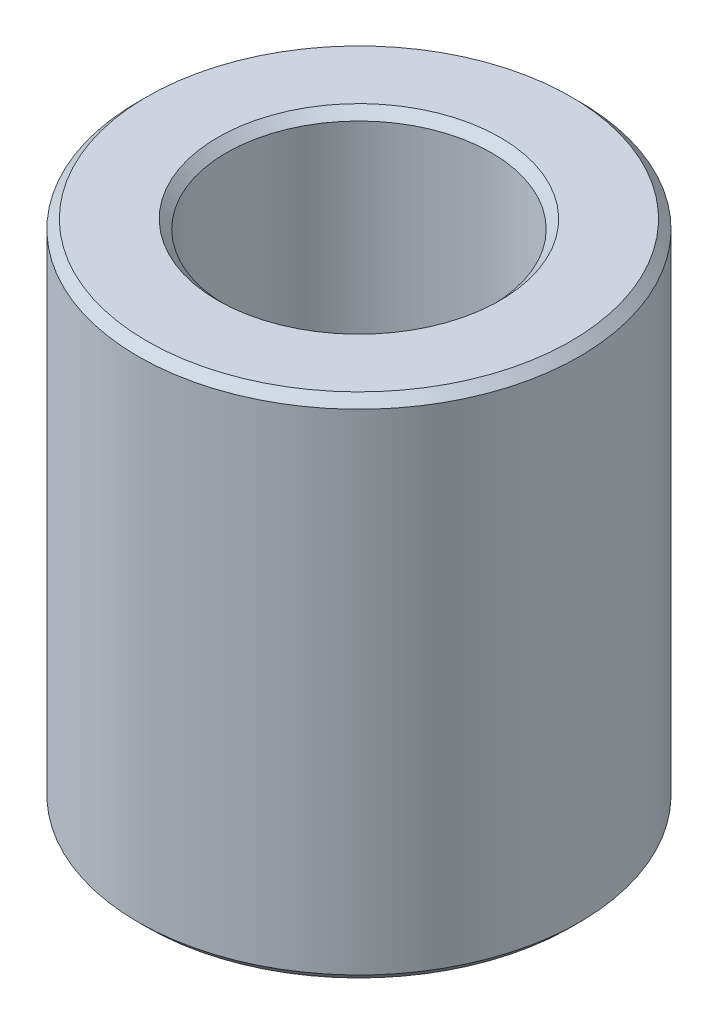
from build123d import *

# Parameters (mm, degrees)
SKETCH1_R           = 5
SKETCH1_R_2         = 3
BOSS_EXTRUDE1_DEPTH = 11.5
CHAMFER1_SIZE       = 0.2


with BuildPart() as part:
    # Sketch1 → Boss-Extrude1 (new body)
    with BuildSketch(Plane(origin=(0, 0, 0), x_dir=(1, 0, 0), z_dir=(0, 1, 0))):
        with Locations(Location((0, 0, 0), (0, 0, 270))):
            Circle(SKETCH1_R)
        with Locations(Location((0, 0, 0), (0, 0, 270))):
            Circle(SKETCH1_R_2, mode=Mode.SUBTRACT)
    extrude(amount=BOSS_EXTRUDE1_DEPTH)

    # Chamfer1
    chamfer1_edges = [part.edges().sort_by_distance(p)[0] for p in [
        (0, 0, -5),
        (0, 11.5, -5),
        (0, 0, -3),
        (0, 11.5, -3),
    ]]
    chamfer(chamfer1_edges, length=CHAMFER1_SIZE)


solid = part.part
